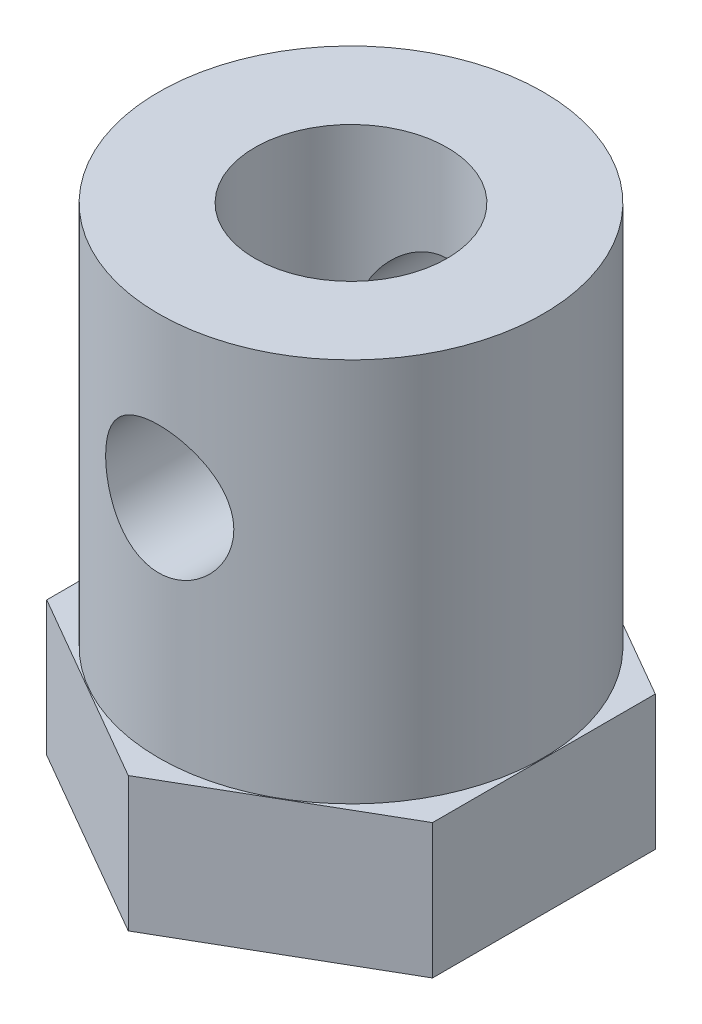
from build123d import *

# Parameters (mm, degrees)
SALIENTE_EXTRUIR1_DEPTH    = 4.2
CROQUIS2_R                 = 6
SALIENTE_EXTRUIR2_DEPTH    = 12
CROQUIS3_R                 = 3
CORTAR_EXTRUIR1_DEPTH      = 19.627961062
CORTAR_EXTRUIR2_DEPTH      = 19.627961062
CORTAR_EXTRUIR2_DEPTH_BACK = 19.627961062
CROQUIS4_R                 = 2


with BuildPart() as part:
    # Croquis1 → Saliente-Extruir1 (new body)
    with BuildSketch(Plane(origin=(0, 0, 0), x_dir=(1, 0, 0), z_dir=(0, 1, 0))):
        Polygon((0, 6.951297241), (-6.02, 3.475648621), (-6.02, -3.475648621), (0, -6.951297241), (6.02, -3.475648621), (6.02, 3.475648621), align=None)
    extrude(amount=SALIENTE_EXTRUIR1_DEPTH)

    # Croquis2 → Saliente-Extruir2 (add)
    with BuildSketch(Plane(origin=(0, 4.2, 0), x_dir=(1, 0, 0), z_dir=(0, 1, 0))):
        with Locations(Location((0, 0, 0), (0, 0, 270))):
            Circle(CROQUIS2_R)
    extrude(amount=SALIENTE_EXTRUIR2_DEPTH)

    # Croquis3 → Cortar-Extruir1 (cut, through all)
    with BuildSketch(Plane(origin=(0, 16.2, 0), x_dir=(1, 0, 0), z_dir=(0, 1, 0))):
        with Locations(Location((0, 0, 0), (0, 0, 270))):
            Circle(CROQUIS3_R)
    extrude(amount=-CORTAR_EXTRUIR1_DEPTH, mode=Mode.SUBTRACT)

    # Croquis4 → Cortar-Extruir2 (cut, two sides: drawn at the far end of the back side and taken through both)
    with BuildSketch(Plane.XY.offset(-CORTAR_EXTRUIR2_DEPTH_BACK)):
        with Locations((0, 11.2)):
            Circle(CROQUIS4_R)
    extrude(amount=CORTAR_EXTRUIR2_DEPTH + CORTAR_EXTRUIR2_DEPTH_BACK, mode=Mode.SUBTRACT)


solid = part.part
